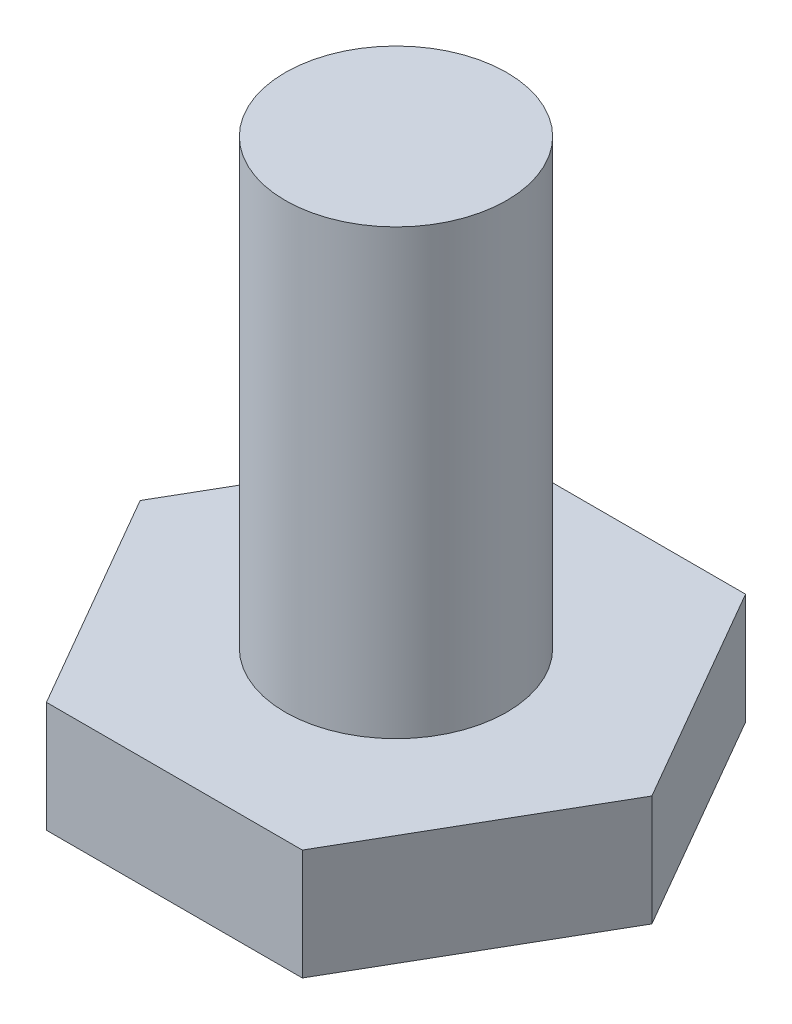
from build123d import *

# Parameters (mm, degrees)
BOSS_EXTRUDE1_DEPTH = 2
SKETCH2_R           = 2
BOSS_EXTRUDE2_DEPTH = 10


with BuildPart() as part:
    # Sketch1 → Boss-Extrude1 (new body)
    with BuildSketch(Plane(origin=(0, 0, 0), x_dir=(1, 0, 0), z_dir=(0, 1, 0))):
        Polygon((-2.309401077, 4), (-4.618802154, 0), (-2.309401077, -4), (2.309401077, -4), (4.618802154, 0), (2.309401077, 4), align=None)
    extrude(amount=BOSS_EXTRUDE1_DEPTH)

    # Sketch2 → Boss-Extrude2 (add)
    with BuildSketch(Plane(origin=(0, 0, 0), x_dir=(1, 0, 0), z_dir=(0, 1, 0))):
        with Locations(Location((0, 0, 0), (0, 0, 270))):
            Circle(SKETCH2_R)
    extrude(amount=BOSS_EXTRUDE2_DEPTH)


solid = part.part
